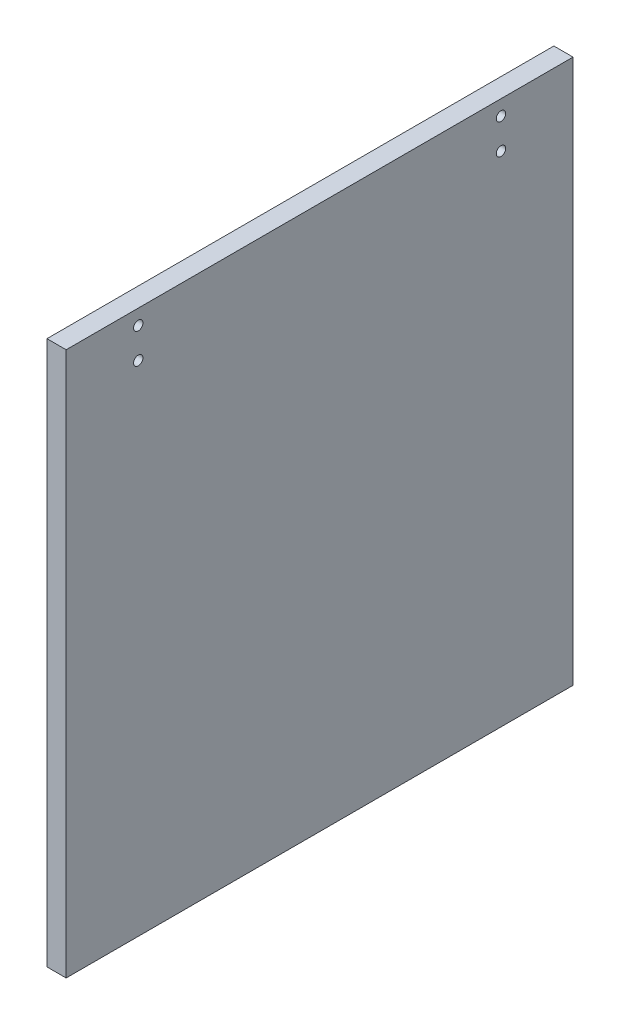
from build123d import *

# Parameters (mm, degrees)
SKETCH1_W           = 167.7
SKETCH1_H           = 180
BOSS_EXTRUDE1_DEPTH = 6.35
SKETCH2_R           = 1.554
CUT_EXTRUDE1_DEPTH  = 124.171201991


with BuildPart() as part:
    # Sketch1 → Boss-Extrude1 (new body)
    with BuildSketch(Plane(origin=(0, 0, 0), x_dir=(0, 0, -1), z_dir=(1, 0, 0))):
        Rectangle(SKETCH1_W, SKETCH1_H)
    extrude(amount=BOSS_EXTRUDE1_DEPTH)

    # Sketch2 → Cut-Extrude1 (cut, through all)
    with BuildSketch(Plane.ZY):
        with Locations((59.999999948, 84.999999528)):
            Circle(SKETCH2_R)
        with Locations((-59.999999948, 84.999999528)):
            Circle(SKETCH2_R)
        with Locations((-59.999999948, 74.999999528)):
            Circle(SKETCH2_R)
        with Locations((59.999999948, 74.999999528)):
            Circle(SKETCH2_R)
    extrude(amount=-CUT_EXTRUDE1_DEPTH, mode=Mode.SUBTRACT)


solid = part.part
